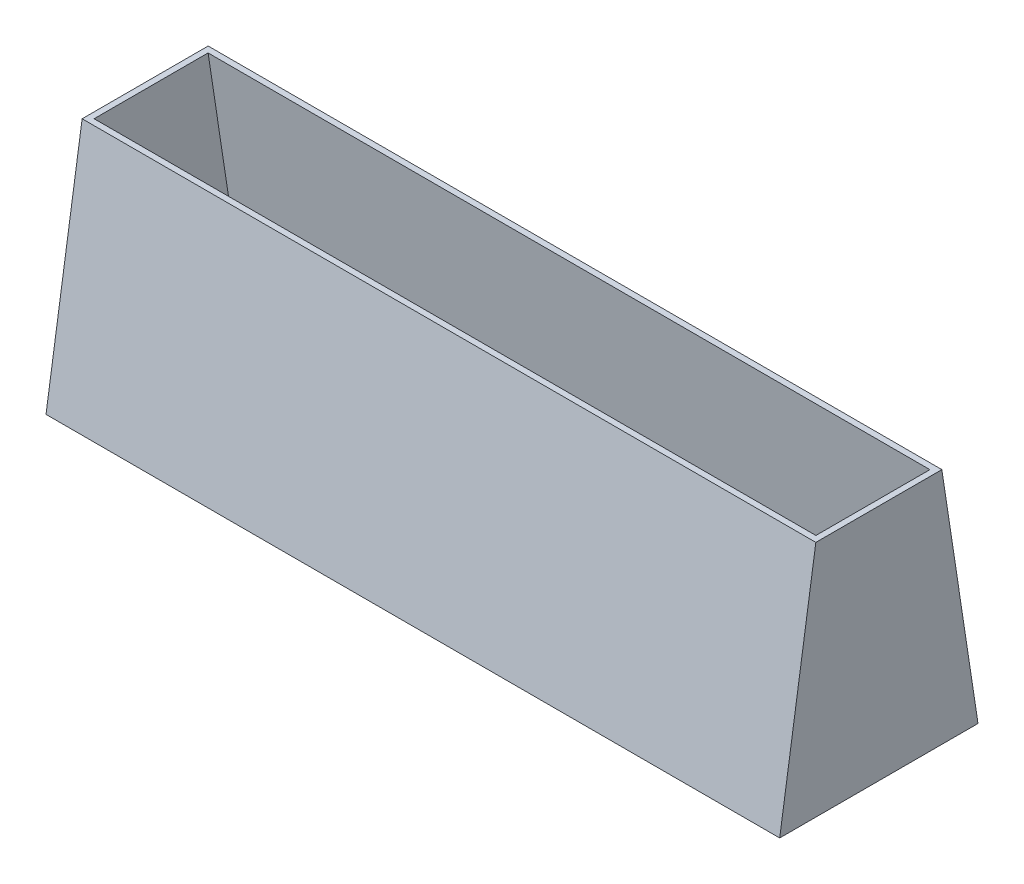
from build123d import *

# Parameters (mm, degrees)
BOSS_EXTRUDE1_DEPTH = 370
SHELL1_T            = -3
BOSS_EXTRUDE2_REACH = 398.278
SKETCH3_W           = 50
SKETCH3_H           = 3


with BuildPart() as part:
    # Sketch2 → Boss-Extrude1 (new body)
    with BuildSketch(Plane(origin=(0, 0, 0), x_dir=(0, 0, -1), z_dir=(1, 0, 0))):
        Polygon((100, 0), (0, 0), (18.222222222, 120), (81.777777778, 120), align=None)
    extrude(amount=BOSS_EXTRUDE1_DEPTH)

    # Shell1
    shell1_openings = [part.faces().sort_by_distance(p)[0] for p in [
        (185, 120, -50),
    ]]
    offset(amount=SHELL1_T, openings=shell1_openings, kind=Kind.INTERSECTION)

    # Boss-Extrude2: up to this plane
    boss_extrude2_end = Plane(origin=(370, 119.549607645, -21.188220659), z_dir=(0, -0.15013078506635866, -0.9886661455594395))
    # Sketch3 → Boss-Extrude2 (add, up to the surface)
    with BuildSketch(Plane(origin=(0, 14.392530105, -94.780076301), x_dir=(1, 0, 0), z_dir=(0, -0.1501307850664947, 0.988666145559419)), mode=Mode.PRIVATE) as boss_extrude2_sk1:
        with Locations((305, 29.976868399)):
            Rectangle(SKETCH3_W, SKETCH3_H)
    boss_extrude2_tool1 = split(extrude(boss_extrude2_sk1.sketch, amount=BOSS_EXTRUDE2_REACH, mode=Mode.PRIVATE), bisect_by=boss_extrude2_end, keep=Keep.BOTH, mode=Mode.PRIVATE)
    add(boss_extrude2_tool1.solids().sort_by_distance((305, 44.029645, -90.279626))[0])


solid = part.part
